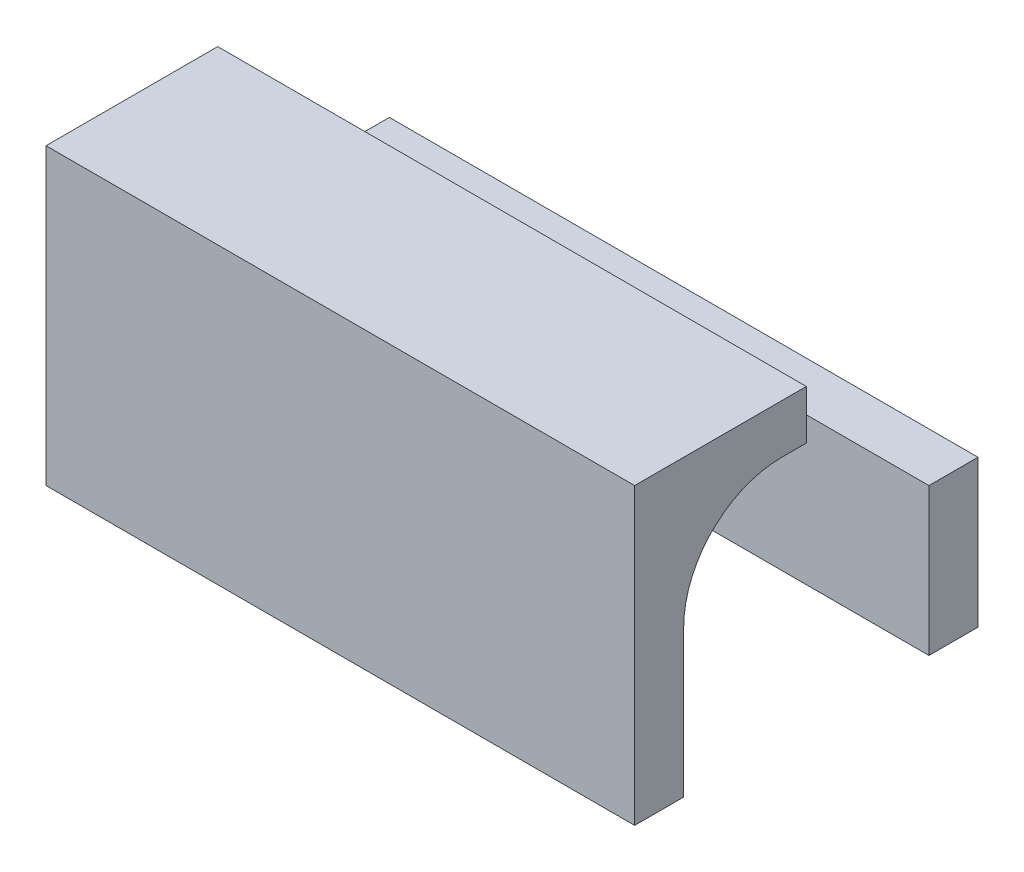
from build123d import *

# Parameters (mm, degrees)
SKETCH1_W             = 1000
SKETCH1_H             = 3000
BOSS_EXTRUDE1_DEPTH   = 12000
BOSS_EXTRUDE1_2_DEPTH = 12000


with BuildPart() as part:
    # Sketch1 → Boss-Extrude1 (new body)
    with BuildSketch(Plane(origin=(0, 0, 0), x_dir=(0, 0, -1), z_dir=(1, 0, 0))):
        with Locations((6500, 1500)):
            Rectangle(SKETCH1_W, SKETCH1_H)
    extrude(amount=BOSS_EXTRUDE1_DEPTH)


with BuildPart() as body_2:
    # Sketch1 → Boss-Extrude1 2 (new body)
    with BuildSketch(Plane(origin=(0, 0, 0), x_dir=(0, 0, -1), z_dir=(1, 0, 0))):
        with BuildLine():
            Line((0, 0), (1000, 0))
            Line((1000, 0), (1000, 3000))
            ThreePointArc((1000, 3000), (1585.786437627, 4414.213562373), (3000, 5000))
            Line((3000, 5000), (3500, 5000))
            Line((3500, 5000), (3500, 6000))
            Line((3500, 6000), (0, 6000))
            Line((0, 6000), (0, 0))
        make_face()
    extrude(amount=BOSS_EXTRUDE1_2_DEPTH)


solid = Compound([part.part, body_2.part])
